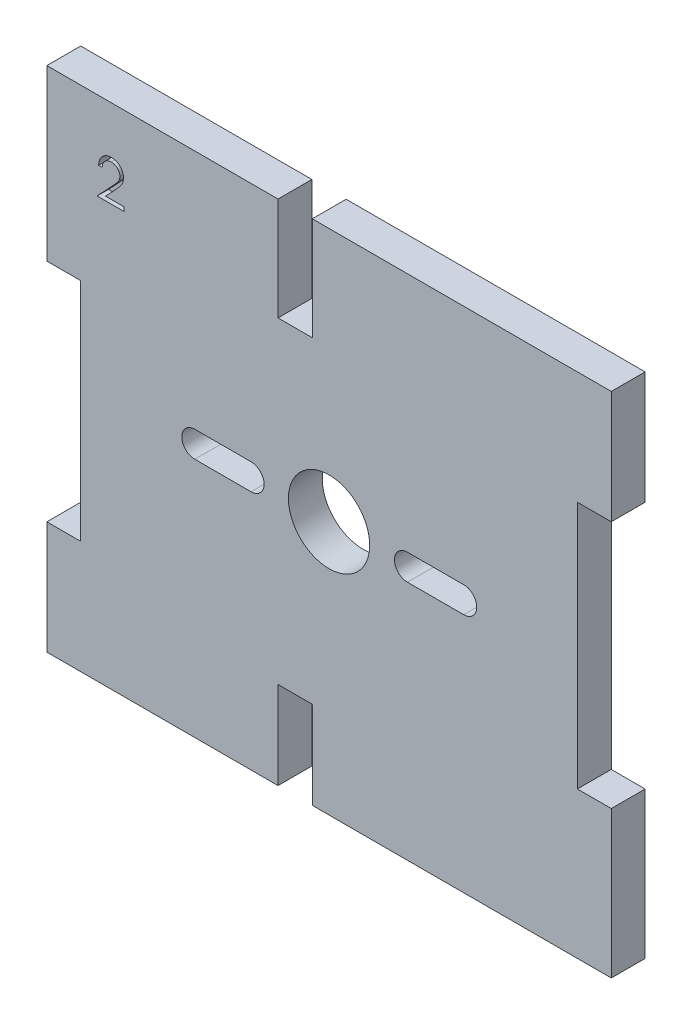
from build123d import *

# Parameters (mm, degrees)
SKETCH_1_R          = 3.6
EXTRUDE_1_DEPTH     = 3
CUT_EXTRUDE_2_DEPTH = 1


with BuildPart() as part:
    # 草图1 → 凸台-拉伸1 (new body)
    with BuildSketch(Plane.XY.offset(3)):
        Polygon((46.131858504, 44.9999), (19.645182907, 44.9999), (19.645182907, 35.877980345), (16.61, 35.877980345), (16.61, 44.9999), (-3.867371496, 44.9999), (-3.867371496, 29.9998), (-0.867341496, 29.9998), (-0.867341496, 9.9991), (-3.867371496, 9.9991), (-3.867371496, 0), (16.61, 0), (16.61, 7.754820329), (19.645182907, 7.754820329), (19.645182907, 0), (46.131858504, 0), (46.131858504, 13.0005), (43.131858504, 13.0005), (43.131858504, 34.9994), (46.131858504, 34.9994), align=None)
        with Locations(Location((21.131658504, 22.4992, 0), (0, 0, 180))):
            Circle(SKETCH_1_R, mode=Mode.SUBTRACT)
        with BuildLine():
            Line((9.236684618, 23.64925), (14.226589495, 23.64925))
            ThreePointArc((14.226589495, 23.64925), (15.376589495, 22.49925), (14.226589495, 21.34925))
            Line((14.226589495, 21.34925), (9.236684618, 21.34925))
            ThreePointArc((9.236684618, 21.34925), (8.086684618, 22.49925), (9.236684618, 23.64925))
        make_face(mode=Mode.SUBTRACT)
        with BuildLine():
            Line((33.064389495, 21.33685), (28.074484618, 21.33685))
            ThreePointArc((28.074484618, 21.33685), (26.924484618, 22.48685), (28.074484618, 23.63685))
            Line((28.074484618, 23.63685), (33.064389495, 23.63685))
            ThreePointArc((33.064389495, 23.63685), (34.214389495, 22.48685), (33.064389495, 21.33685))
        make_face(mode=Mode.SUBTRACT)
    extrude(amount=-EXTRUDE_1_DEPTH)

    # 草图3 → 切除-拉伸2 (cut)
    with BuildSketch(Plane.XY.offset(3)):
        with BuildLine():
            Line((1.034005341, 39.645473757), (0.719902777, 39.645473757))
            add(Edge.make_bspline(
                [(0.719902777, 39.645473757), (0.72194993, 39.687144645), (0.725970484, 39.768985159), (0.744798774, 39.888309066), (0.771739651, 40.002363865), (0.809831105, 40.110233779), (0.857137383, 40.212872586), (0.91386741, 40.309872601), (0.98106126, 40.40086379), (1.057267995, 40.485002633), (1.140036634, 40.562190204), (1.229342573, 40.628845447), (1.3231876, 40.685163118), (1.421286999, 40.73224436), (1.524747563, 40.767584206), (1.632630421, 40.793805846), (1.745409557, 40.809582191), (1.822249579, 40.811277977), (1.861329059, 40.812140424)],
                knots=[0, 0, 0, 0, 1.10065271, 2.161652631, 3.183658789, 4.190468796, 5.17591951, 6.163126047, 7.15150782, 8.156236427, 9.156009102, 10.134482811, 11.092018607, 12.041330605, 13.001268258, 13.972401359, 14.968799086, 16, 16, 16, 16], degree=3))
            add(Edge.make_bspline(
                [(1.861329059, 40.812140424), (1.899707133, 40.811241967), (1.975118678, 40.809476532), (2.085180693, 40.794315503), (2.189957987, 40.770569912), (2.289245754, 40.737254495), (2.382251818, 40.692470068), (2.469674863, 40.638672529), (2.552555673, 40.576452698), (2.627162457, 40.503198884), (2.695670536, 40.4249965), (2.754772791, 40.341508596), (2.805385955, 40.255279311), (2.847573635, 40.165651109), (2.878629774, 40.071780081), (2.902207982, 39.975032878), (2.915535395, 39.874408067), (2.917580819, 39.806301511), (2.918620726, 39.77167568)],
                knots=[0, 0, 0, 0, 1.111607364, 2.184268762, 3.212621178, 4.221274766, 5.211760367, 6.196651075, 7.1921475, 8.207485113, 9.220403448, 10.201281604, 11.166441695, 12.114753415, 13.065576456, 14.026450734, 14.996634279, 16, 16, 16, 16], degree=3))
            add(Edge.make_bspline(
                [(2.918620726, 39.77167568), (2.916927463, 39.722927846), (2.913570652, 39.626287632), (2.884856275, 39.484272769), (2.840009764, 39.34667935), (2.786012407, 39.235942048), (2.731539963, 39.146708554), (2.682452456, 39.073239849), (2.624987645, 38.994134381), (2.558309147, 38.909657044), (2.483796274, 38.819146138), (2.400774111, 38.722656343), (2.308650629, 38.621184573), (2.243992128, 38.551878972), (2.210487713, 38.515966546)],
                knots=[0, 0, 0, 0, 1.184426356, 2.348067706, 3.509069118, 4.696110526, 5.333549288, 6.050745305, 6.844228056, 7.710549037, 8.667450064, 9.695053472, 10.805634456, 12, 12, 12, 12], degree=3))
            Line((2.210487713, 38.515966546), (1.334786591, 37.581371193))
            Line((1.334786591, 37.581371193), (2.963492521, 37.581371193))
            Line((2.963492521, 37.581371193), (2.963492521, 37.222396834))
            Line((2.963492521, 37.222396834), (0.585287393, 37.222396834))
            Line((0.585287393, 37.222396834), (1.942659188, 38.670914462))
            add(Edge.make_bspline(
                [(1.942659188, 38.670914462), (1.975707074, 38.705412769), (2.039185301, 38.771676955), (2.128967878, 38.868419915), (2.209606867, 38.958169456), (2.281624259, 39.040756005), (2.343457765, 39.117387572), (2.398329997, 39.185582276), (2.442295588, 39.248336726), (2.490010983, 39.32107734), (2.536224965, 39.409889657), (2.575937321, 39.518423347), (2.600152169, 39.630150599), (2.603057005, 39.705652636), (2.604518162, 39.743630808)],
                knots=[0, 0, 0, 0, 1.329631726, 2.553950428, 3.673215718, 4.687767853, 5.603093632, 6.413772471, 7.123043292, 7.734684054, 8.834405432, 9.900288307, 10.943827018, 12, 12, 12, 12], degree=3))
            add(Edge.make_bspline(
                [(2.604518162, 39.743630808), (2.60388242, 39.767512207), (2.602629494, 39.814577857), (2.591571796, 39.883583616), (2.57486129, 39.95014843), (2.550916032, 40.014477049), (2.519309292, 40.075922701), (2.480835912, 40.134560181), (2.436445849, 40.191249147), (2.385094579, 40.244402445), (2.328683059, 40.29308365), (2.26908881, 40.336207736), (2.206038706, 40.372246846), (2.139798583, 40.401790343), (2.070553114, 40.424965725), (1.998168369, 40.441024304), (1.922844353, 40.451106788), (1.871410857, 40.45247096), (1.845203258, 40.453166065)],
                knots=[0, 0, 0, 0, 0.991446411, 1.95395049, 2.89581595, 3.838931463, 4.798493298, 5.75982156, 6.748411868, 7.785213223, 8.824556874, 9.840280684, 10.836137867, 11.835679398, 12.848801643, 13.863922112, 14.911575587, 16, 16, 16, 16], degree=3))
            add(Edge.make_bspline(
                [(1.845203258, 40.453166065), (1.817832425, 40.452451033), (1.764080629, 40.451046827), (1.685161596, 40.441224163), (1.609875819, 40.424278323), (1.538033916, 40.401101648), (1.46951433, 40.3716431), (1.404650286, 40.334951355), (1.343587397, 40.291167862), (1.286210873, 40.241527305), (1.233346894, 40.186259704), (1.186900018, 40.124649741), (1.146316004, 40.057822326), (1.110906771, 39.985957775), (1.082151081, 39.908403995), (1.06017793, 39.82543629), (1.042791083, 39.737414909), (1.036982563, 39.676629824), (1.034005341, 39.645473757)],
                knots=[0, 0, 0, 0, 1.031018746, 2.02475058, 2.990194455, 3.934040569, 4.864654155, 5.795059489, 6.735614925, 7.690564532, 8.649604399, 9.611025574, 10.590972636, 11.591080095, 12.624614302, 13.701020113, 14.821632451, 16, 16, 16, 16], degree=3))
        make_face()
    extrude(amount=-CUT_EXTRUDE_2_DEPTH, mode=Mode.SUBTRACT)


solid = part.part
